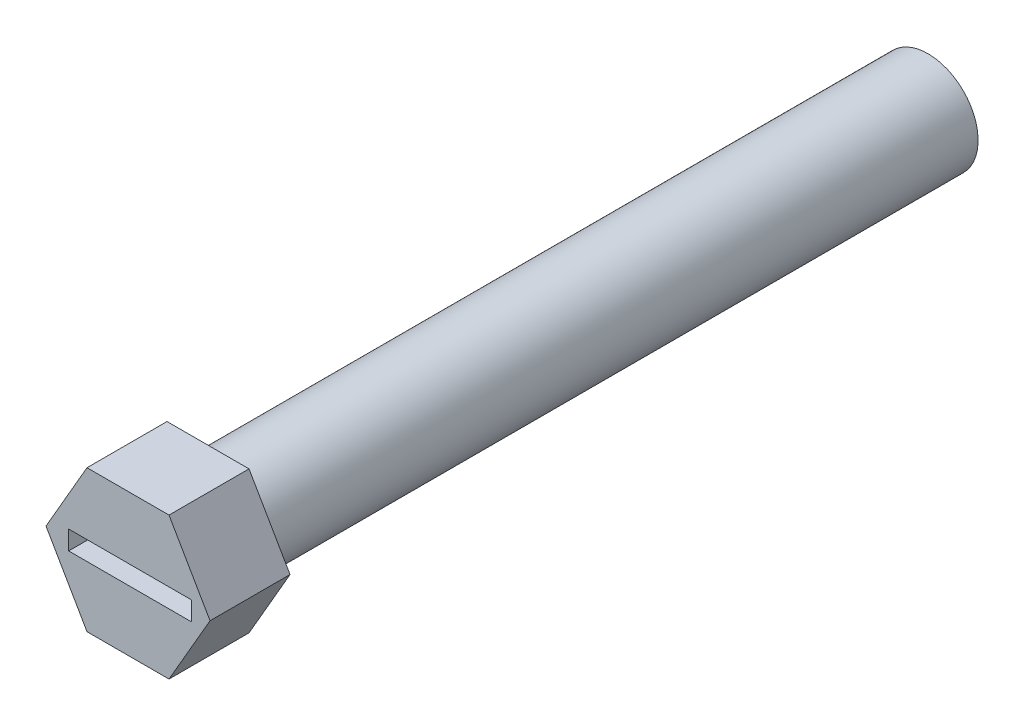
from build123d import *

# Parameters (mm, degrees)
SKETCH1_R           = 12.5
BOSS_EXTRUDE1_DEPTH = 180
BOSS_EXTRUDE2_DEPTH = 20
SKETCH3_W           = 30.675059353
SKETCH3_H           = 4.752473984
CUT_EXTRUDE1_DEPTH  = 15


with BuildPart() as part:
    # Sketch1 → Boss-Extrude1 (new body)
    with BuildSketch(Plane.XY):
        with Locations(Location((0, 0, 0), (0, 0, 180))):
            Circle(SKETCH1_R)
    extrude(amount=BOSS_EXTRUDE1_DEPTH)

    # Sketch2 → Boss-Extrude2 (add)
    with BuildSketch(Plane.XY.offset(180)):
        Polygon((20.501198272, 0), (10.250599136, 17.754558511), (-10.250599136, 17.754558511), (-20.501198272, 0), (-10.250599136, -17.754558511), (10.250599136, -17.754558511), align=None)
    extrude(amount=BOSS_EXTRUDE2_DEPTH)

    # Sketch3 → Cut-Extrude1 (cut)
    with BuildSketch(Plane.XY.offset(200)):
        with Locations((0.504050272, -0.180017954)):
            Rectangle(SKETCH3_W, SKETCH3_H)
    extrude(amount=-CUT_EXTRUDE1_DEPTH, mode=Mode.SUBTRACT)


solid = part.part
